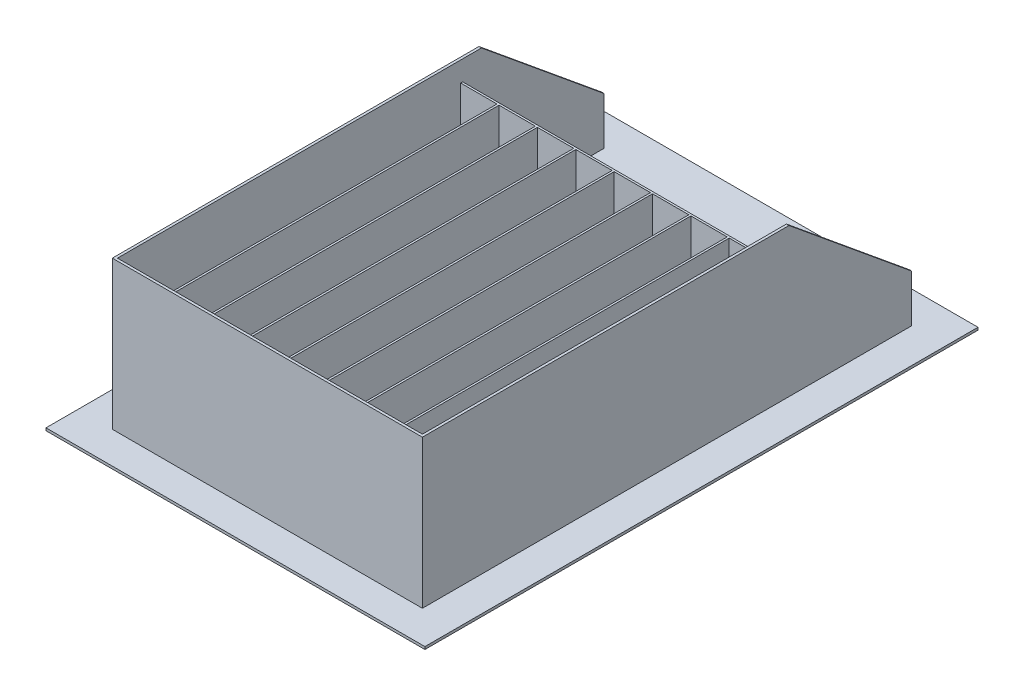
from build123d import *

# Parameters (mm, degrees)
SKETCH1_W            = 388.7
SKETCH1_H            = 435.95
SKETCH1_W_2          = 45.6
SKETCH1_H_2          = 430.25
BOSS_EXTRUDE1_DEPTH  = 189
BOSS_EXTRUDE2_START  = -433.45
SKETCH2_W            = 388.7
SKETCH2_H            = 3.2
BOSS_EXTRUDE2_DEPTH  = 430.25
CUT_EXTRUDE1_DEPTH   = 25
BOSS_EXTRUDE4_DEPTH  = 3.2
BOSS_EXTRUDE5_DEPTH  = 3.2
BOSS_EXTRUDE6_REACH  = 791.664
CUT_EXTRUDE2_REACH   = 793.231
SKETCH11_W           = 52.59
SKETCH11_H           = 168.019571709
BOSS_EXTRUDE7_DEPTH  = 3.2
BOSS_EXTRUDE8_DEPTH  = 3.2
SKETCH14_W           = 388.7
SKETCH14_H           = 3.2
BOSS_EXTRUDE9_DEPTH  = 40
SKETCH15_W           = 388.7
SKETCH15_H           = 3.2
BOSS_EXTRUDE10_DEPTH = 40
SKETCH16_W           = 693.36
SKETCH16_H           = 3.2
BOSS_EXTRUDE11_DEPTH = 43.15
SKETCH17_W           = 693.36
SKETCH17_H           = 3.2
BOSS_EXTRUDE12_DEPTH = 43.15


with BuildPart() as part:
    # Sketch1 → Boss-Extrude1 (new body)
    with BuildSketch(Plane(origin=(0, 0, 0), x_dir=(1, 0, 0), z_dir=(0, 1, 0))):
        with Locations((191.15, 214.775)):
            Rectangle(SKETCH1_W, SKETCH1_H)
        with Locations((22.8, 215.125)):
            Rectangle(SKETCH1_W_2, SKETCH1_H_2, mode=Mode.SUBTRACT)
        with Locations((359.5, 215.125)):
            Rectangle(SKETCH1_W_2, SKETCH1_H_2, mode=Mode.SUBTRACT)
        with Locations((70.9, 215.125)):
            Rectangle(SKETCH1_W_2, SKETCH1_H_2, mode=Mode.SUBTRACT)
        with Locations((119, 215.125)):
            Rectangle(SKETCH1_W_2, SKETCH1_H_2, mode=Mode.SUBTRACT)
        with Locations((167.1, 215.125)):
            Rectangle(SKETCH1_W_2, SKETCH1_H_2, mode=Mode.SUBTRACT)
        with Locations((215.2, 215.125)):
            Rectangle(SKETCH1_W_2, SKETCH1_H_2, mode=Mode.SUBTRACT)
        with Locations((263.3, 215.125)):
            Rectangle(SKETCH1_W_2, SKETCH1_H_2, mode=Mode.SUBTRACT)
        with Locations((311.4, 215.125)):
            Rectangle(SKETCH1_W_2, SKETCH1_H_2, mode=Mode.SUBTRACT)
    extrude(amount=BOSS_EXTRUDE1_DEPTH)

    # Sketch2 → Boss-Extrude2 (add)
    with BuildSketch(Plane.XY.offset(3.2).offset(BOSS_EXTRUDE2_START)):
        with Locations((191.15, 1.6)):
            Rectangle(SKETCH2_W, SKETCH2_H)
    extrude(amount=BOSS_EXTRUDE2_DEPTH)

    # Sketch3 → Cut-Extrude1 (cut)
    with BuildSketch(Plane(origin=(0, 189, 0), x_dir=(1, 0, 0), z_dir=(0, 1, 0))):
        Polygon((0, 430.25), (0, 432.75), (382.3, 432.75), (382.3, 430.25), (336.7, 430.25), (336.7, 0), (334.2, 0), (334.2, 430.25), (288.6, 430.25), (288.6, 0), (286.1, 0), (286.1, 430.25), (240.5, 430.25), (240.5, 0), (238, 0), (238, 430.25), (192.4, 430.25), (192.4, 0), (189.9, 0), (189.9, 430.25), (144.3, 430.25), (144.3, 0), (141.8, 0), (141.8, 430.25), (96.2, 430.25), (96.2, 0), (93.7, 0), (93.7, 430.25), (48.1, 430.25), (48.1, 0), (45.6, 0), (45.6, 430.25), align=None)
    extrude(amount=-CUT_EXTRUDE1_DEPTH, mode=Mode.SUBTRACT)

    # Sketch4 → Boss-Extrude4 (add)
    with BuildSketch(Plane(origin=(385.5, 0, 0), x_dir=(0, 0, -1), z_dir=(1, 0, 0))):
        Polygon((432.75, 189), (662.75, 0), (432.75, 0), align=None)
    extrude(amount=-BOSS_EXTRUDE4_DEPTH)

    # Sketch7 → Boss-Extrude5 (add)
    with BuildSketch(Plane.ZY.offset(3.2)):
        Polygon((-432.75, 164), (-432.75, 189), (-662.75, 0), (-432.75, 0), align=None)
    extrude(amount=-BOSS_EXTRUDE5_DEPTH)

    # Sketch9 → Boss-Extrude6 (add, up to next)
    with BuildSketch(Plane(origin=(0, 0, 0), x_dir=(0, 0, -1), z_dir=(1, 0, 0)), mode=Mode.PRIVATE) as boss_extrude6_sk1:
        Polygon((662.75, 0), (658.855820106, 3.2), (432.75, 3.2), (432.75, 0), align=None)
    boss_extrude6_tool1 = extrude(boss_extrude6_sk1.sketch, amount=BOSS_EXTRUDE6_REACH, mode=Mode.PRIVATE) - part.part
    add(boss_extrude6_tool1.solids().sort_by_distance((0, 1.595446, -546.779226))[0])

    # Sketch11 → Cut-Extrude2 (cut, up to next)
    with BuildSketch(Plane(origin=(385.5, 0, 0), x_dir=(0, 0, -1), z_dir=(1, 0, 0)), mode=Mode.PRIVATE) as cut_extrude2_sk1:
        with Locations((636.455, 84.009785855)):
            Rectangle(SKETCH11_W, SKETCH11_H)
    cut_extrude2_tool1 = extrude(cut_extrude2_sk1.sketch, amount=-CUT_EXTRUDE2_REACH, mode=Mode.PRIVATE) & part.part
    add(cut_extrude2_tool1.solids().sort_by_distance((385.5, 84.009786, -636.455))[0], mode=Mode.SUBTRACT)

    # Sketch12 → Boss-Extrude7 (add)
    with BuildSketch(Plane(origin=(385.5, 0, 0), x_dir=(0, 0, -1), z_dir=(1, 0, 0))):
        Polygon((456.376412276, 189), (610.16, 62.630008348), (610.16, 43.21526087), (432.75, 189), align=None)
    extrude(amount=-BOSS_EXTRUDE7_DEPTH)

    # Sketch13 → Boss-Extrude8 (add)
    with BuildSketch(Plane.ZY.offset(3.2)):
        Polygon((-610.16, 62.630008348), (-610.16, 43.21526087), (-432.75, 189), (-456.376412276, 189), align=None)
    extrude(amount=-BOSS_EXTRUDE8_DEPTH)

    # Sketch14 → Boss-Extrude9 (add)
    with BuildSketch(Plane(origin=(0, 0, -610.16), x_dir=(-1, 0, 0), z_dir=(0, 0, -1))):
        with Locations((-191.15, 1.6)):
            Rectangle(SKETCH14_W, SKETCH14_H)
    extrude(amount=BOSS_EXTRUDE9_DEPTH)

    # Sketch15 → Boss-Extrude10 (add)
    with BuildSketch(Plane.XY.offset(3.2)):
        with Locations((191.15, 1.6)):
            Rectangle(SKETCH15_W, SKETCH15_H)
    extrude(amount=BOSS_EXTRUDE10_DEPTH)

    # Sketch16 → Boss-Extrude11 (add)
    with BuildSketch(Plane(origin=(385.5, 0, 0), x_dir=(0, 0, -1), z_dir=(1, 0, 0))):
        with Locations((303.48, 1.6)):
            Rectangle(SKETCH16_W, SKETCH16_H)
    extrude(amount=BOSS_EXTRUDE11_DEPTH)

    # Sketch17 → Boss-Extrude12 (add)
    with BuildSketch(Plane.ZY.offset(3.2)):
        with Locations((-303.48, 1.6)):
            Rectangle(SKETCH17_W, SKETCH17_H)
    extrude(amount=BOSS_EXTRUDE12_DEPTH)


solid = part.part
